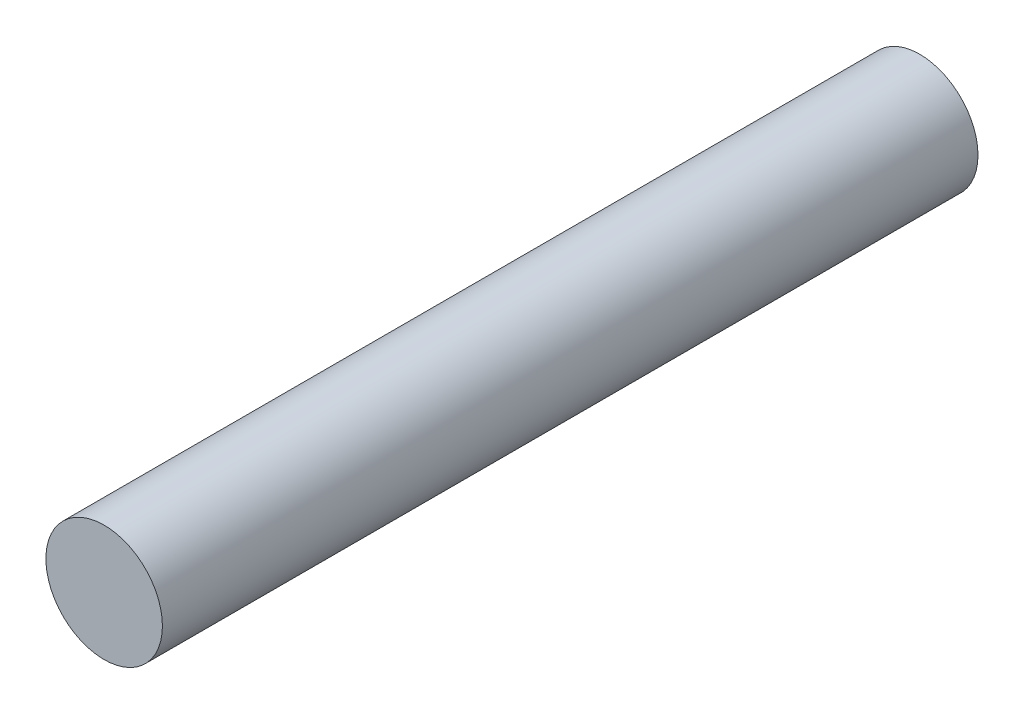
from build123d import *

# Parameters (mm, degrees)
SKETCH1_R           = 4
BOSS_EXTRUDE1_DEPTH = 56


with BuildPart() as part:
    # Sketch1 → Boss-Extrude1 (new body)
    with BuildSketch(Plane.XY):
        Circle(SKETCH1_R)
    extrude(amount=BOSS_EXTRUDE1_DEPTH)


solid = part.part
